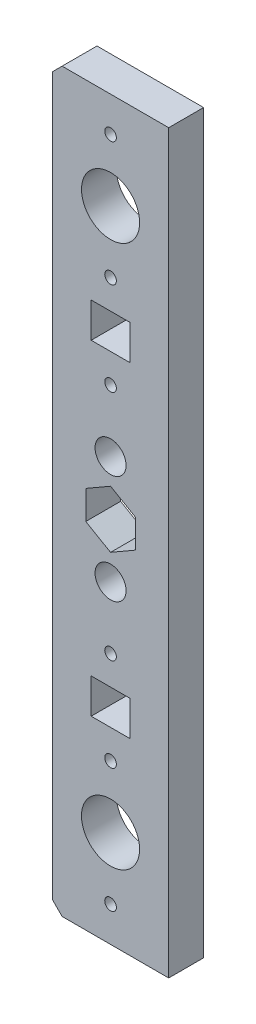
from build123d import *

# Parameters (mm, degrees)
MODEL_R             = 7.5
MODEL_R_2           = 4
MODEL_R_3           = 1.5
MODEL_W             = 10
MODEL_H             = 9
BOSS_EXTRUDE1_DEPTH = 9


with BuildPart() as part:
    # Model → Boss-Extrude1 (new body)
    with BuildSketch(Plane.XY):
        Polygon((-27.5, 0), (0, 0), (0, 190), (-27.5, 190), (-30, 187.5), (-30, 2.5), align=None)
        with Locations((-15, 165)):
            Circle(MODEL_R, mode=Mode.SUBTRACT)
        with Locations((-15, 109)):
            Circle(MODEL_R_2, mode=Mode.SUBTRACT)
        with Locations(Location((-15, 25, 0), (0, 0, 180))):
            Circle(MODEL_R, mode=Mode.SUBTRACT)
        with Locations(Location((-15, 81, 0), (0, 0, 180))):
            Circle(MODEL_R_2, mode=Mode.SUBTRACT)
        with Locations((-15, 181)):
            Circle(MODEL_R_3, mode=Mode.SUBTRACT)
        with Locations(Location((-15, 9, 0), (0, 0, 180))):
            Circle(MODEL_R_3, mode=Mode.SUBTRACT)
        with Locations(Location((-15, 149, 0), (0, 0, 180))):
            Circle(MODEL_R_3, mode=Mode.SUBTRACT)
        with Locations((-15, 41)):
            Circle(MODEL_R_3, mode=Mode.SUBTRACT)
        with Locations((-15, 125)):
            Circle(MODEL_R_3, mode=Mode.SUBTRACT)
        with Locations(Location((-15, 65, 0), (0, 0, 180))):
            Circle(MODEL_R_3, mode=Mode.SUBTRACT)
        with Locations((-15, 137)):
            Rectangle(MODEL_W, MODEL_H, mode=Mode.SUBTRACT)
        with Locations((-15, 53)):
            Rectangle(MODEL_W, MODEL_H, mode=Mode.SUBTRACT)
        Polygon((-15, 87.609916554), (-8.6, 91.304958277), (-8.6, 98.695041723), (-15, 102.390083446), (-21.4, 98.695041723), (-21.4, 91.304958277), align=None, mode=Mode.SUBTRACT)
    extrude(amount=BOSS_EXTRUDE1_DEPTH)


solid = part.part
